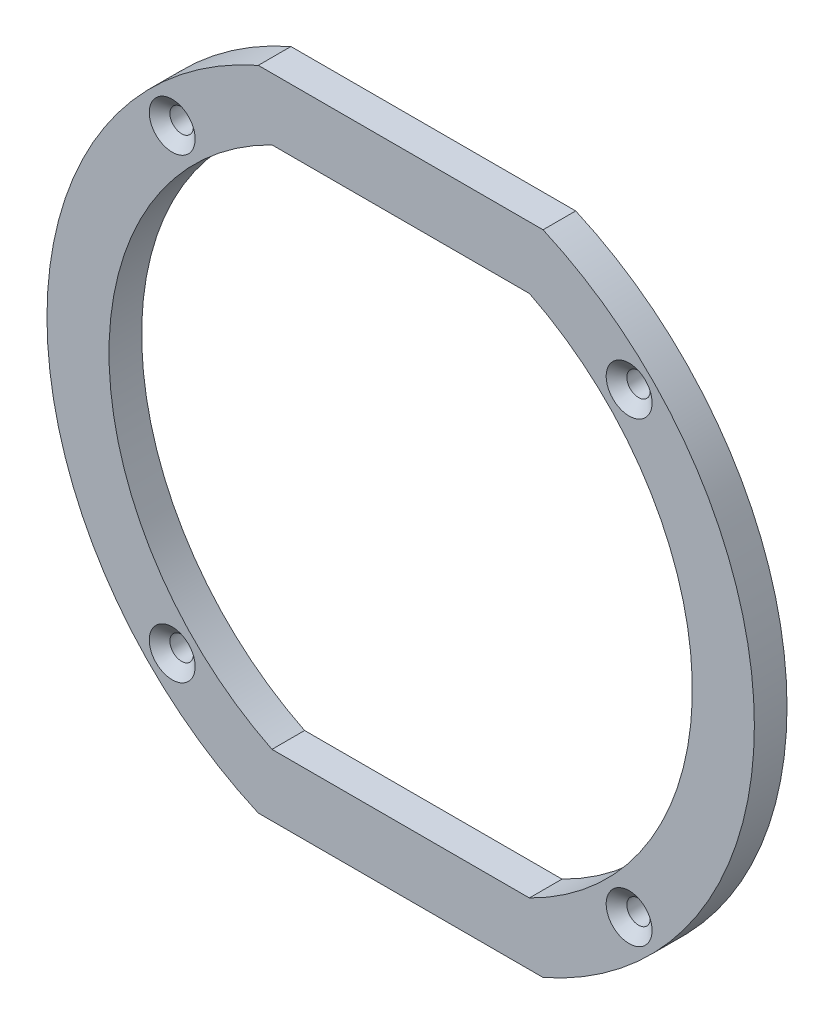
from build123d import *

# Parameters (mm, degrees)
BOSS_EXTRUDE1_DEPTH                               = 6
CSK_FOR_8_FLAT_HEAD_MACHINE_SCREW_100_D           = 4.3053
CSK_FOR_8_FLAT_HEAD_MACHINE_SCREW_100_CSINK_D     = 8.4328
CSK_FOR_8_FLAT_HEAD_MACHINE_SCREW_100_CSINK_ANGLE = 100
SKETCH5_R                                         = 1.905
BOSS_EXTRUDE2_DEPTH                               = 2.5


with BuildPart() as part:
    # Sketch1 → Boss-Extrude1 (new body)
    with BuildSketch(Plane.XY):
        with BuildLine():
            Line((-26.167728216, 59.5), (26.167728216, 59.5))
            ThreePointArc((26.167728216, 59.5), (65, 0), (26.167728216, -59.5))
            Line((26.167728216, -59.5), (-26.167728216, -59.5))
            ThreePointArc((-26.167728216, -59.5), (-65, 0), (-26.167728216, 59.5))
        make_face()
        with BuildLine():
            Line((-23.650581388, 48.1), (23.650581388, 48.1))
            ThreePointArc((23.650581388, 48.1), (53.6, 0), (23.650581388, -48.1))
            Line((23.650581388, -48.1), (-23.650581388, -48.1))
            ThreePointArc((-23.650581388, -48.1), (-53.6, 0), (-23.650581388, 48.1))
        make_face(mode=Mode.SUBTRACT)
    extrude(amount=BOSS_EXTRUDE1_DEPTH)

    # CSK for #8 Flat Head Machine Screw (100)1 (through all)
    with Locations(Plane.XY.offset(6)):
        with Locations((0, 0), (41.985, 41.985), (-41.985, -41.985), (-41.985, 41.985), (41.985, -41.985)):
            CounterSinkHole(CSK_FOR_8_FLAT_HEAD_MACHINE_SCREW_100_D / 2, CSK_FOR_8_FLAT_HEAD_MACHINE_SCREW_100_CSINK_D / 2, counter_sink_angle=CSK_FOR_8_FLAT_HEAD_MACHINE_SCREW_100_CSINK_ANGLE)

    # Sketch5 → Boss-Extrude2 (add)
    with BuildSketch(Plane(origin=(0, 0, 0), x_dir=(-1, 0, 0), z_dir=(0, 0, -1))):
        with Locations(Location((-59.2455, 0, 0), (0, 0, 180))):
            Circle(SKETCH5_R)
        with Locations(Location((59.2455, 0, 0), (0, 0, 180))):
            Circle(SKETCH5_R)
    extrude(amount=BOSS_EXTRUDE2_DEPTH)


solid = part.part
